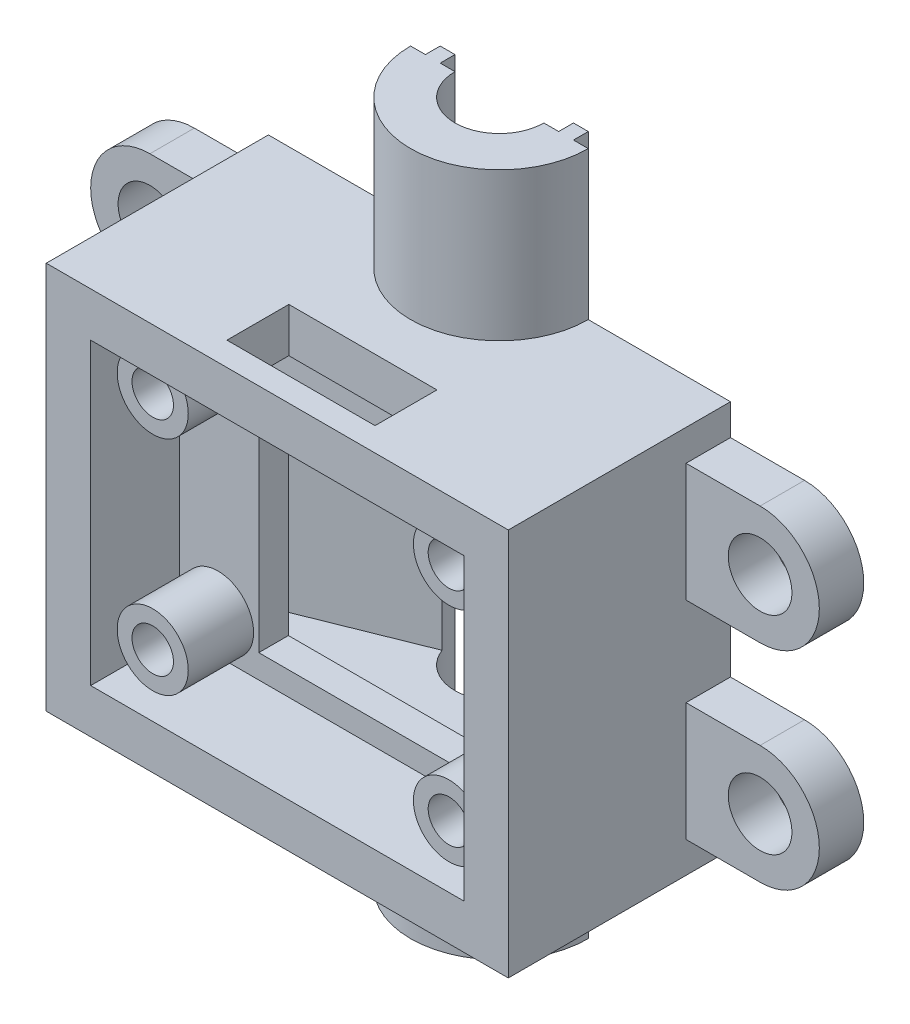
from build123d import *

# Parameters (mm, degrees)
SKETCH1_W            = 31.2
SKETCH1_H            = 26.2
BOSS_EXTRUDE1_DEPTH  = 15
SHELL2_T             = -3
BOSS_EXTRUDE2_DEPTH  = 10
CUT_EXTRUDE2_DEPTH   = 43.175822458
SKETCH8_R            = 2.15
BOSS_EXTRUDE5_DEPTH  = 3
BOSS_EXTRUDE4_DEPTH  = 1
SKETCH14_W           = 25.2
SKETCH14_H           = 20.2
CUT_EXTRUDE5_DEPTH   = 37.163102743
BOSS_EXTRUDE8_REACH  = 45.959
BOSS_EXTRUDE9_START  = -8
SKETCH15_W           = 31.2
SKETCH15_H           = 26.2
SKETCH15_W_2         = 14.5
SKETCH15_H_2         = 17
BOSS_EXTRUDE9_DEPTH  = 2
SKETCH16_R           = 2.4
SKETCH16_R_2         = 1.4
BOSS_EXTRUDE10_DEPTH = 4.41
CUT_EXTRUDE6_REACH   = 48.267
SKETCH5_W            = 10
SKETCH5_H            = 4.18


with BuildPart() as part:
    # Sketch1 → Boss-Extrude1 (new body)
    with BuildSketch(Plane.XY):
        Rectangle(SKETCH1_W, SKETCH1_H)
    extrude(amount=BOSS_EXTRUDE1_DEPTH)

    # Shell2
    shell2_openings = [part.faces().sort_by_distance(p)[0] for p in [
        (0, 0, 0),
    ]]
    offset(amount=SHELL2_T, openings=shell2_openings, kind=Kind.INTERSECTION)

    # Sketch3 → Boss-Extrude2 (add)
    with BuildSketch(Plane(origin=(0, 13.1, 0), x_dir=(1, 0, 0), z_dir=(0, 1, 0))):
        with BuildLine():
            Line((-6, 0), (-3, 0))
            ThreePointArc((-3, 0), (0, -3), (3, 0))
            Line((3, 0), (6, 0))
            ThreePointArc((6, 0), (0, -6), (-6, 0))
        make_face()
    boss_extrude2 = extrude(amount=BOSS_EXTRUDE2_DEPTH)

    # Mirror1: Boss-Extrude2 across plane
    add(boss_extrude2.mirror(Plane.ZX))

    # Sketch4 → Cut-Extrude2 (cut, through all)
    with BuildSketch(Plane(origin=(0, 13.1, 0), x_dir=(1, 0, 0), z_dir=(0, 1, 0))):
        with BuildLine():
            Line((-3, 0), (3, 0))
            ThreePointArc((3, 0), (0, -3), (-3, 0))
        make_face()
    extrude(amount=-CUT_EXTRUDE2_DEPTH, mode=Mode.SUBTRACT)

    # Sketch8 → Boss-Extrude5 (add)
    # profile 1 of 2: a face of its own
    with BuildSketch(Plane(origin=(0, 0, 0), x_dir=(-1, 0, 0), z_dir=(0, 0, -1))):
        with BuildLine():
            Line((-15.6, 3), (-15.6, 11))
            Line((-15.6, 11), (-20.6, 11))
            ThreePointArc((-20.6, 11), (-24.6, 7), (-20.6, 3))
            Line((-20.6, 3), (-15.6, 3))
        make_face()
        with Locations((-20.6, 7)):
            Circle(SKETCH8_R, mode=Mode.SUBTRACT)
    # profile 2 of 2: a face of its own
    with BuildSketch(Plane(origin=(0, 0, 0), x_dir=(-1, 0, 0), z_dir=(0, 0, -1))):
        with BuildLine():
            Line((-15.6, -11), (-15.6, -3))
            Line((-15.6, -3), (-20.6, -3))
            ThreePointArc((-20.6, -3), (-24.6, -7), (-20.6, -11))
            Line((-20.6, -11), (-15.6, -11))
        make_face()
        with Locations((-20.6, -7)):
            Circle(SKETCH8_R, mode=Mode.SUBTRACT)
    boss_extrude5 = extrude(amount=-BOSS_EXTRUDE5_DEPTH)

    # Mirror3: Boss-Extrude5 across plane
    add(boss_extrude5.mirror(Plane(origin=(0, 0, 0), x_dir=(0, 0, 1), z_dir=(1, 0, 0))))

    # Sketch7 → Boss-Extrude4 (add)
    with BuildSketch(Plane(origin=(0, 0, 0), x_dir=(-1, 0, 0), z_dir=(0, 0, -1))):
        Polygon((-4, -23.1), (-4, -11.1), (-13.6, -11.1), (-13.6, 11.1), (-4, 11.1), (-4, 23.1), (-5, 23.1), (-5, 12.1), (-14.6, 12.1), (-14.6, -12.1), (-5, -12.1), (-5, -23.1), align=None)
    boss_extrude4 = extrude(amount=BOSS_EXTRUDE4_DEPTH)

    # Mirror2: Boss-Extrude4 across plane
    add(boss_extrude4.mirror(Plane(origin=(0, 0, 0), x_dir=(0, 0, 1), z_dir=(1, 0, 0))))

    # Sketch14 → Cut-Extrude5 (cut, through all)
    with BuildSketch(Plane(origin=(0, 0, 12), x_dir=(-1, 0, 0), z_dir=(0, 0, -1))):
        Rectangle(SKETCH14_W, SKETCH14_H)
    extrude(amount=-CUT_EXTRUDE5_DEPTH, mode=Mode.SUBTRACT)

    # Sketch11 → Boss-Extrude8 (add, up to next)
    with BuildSketch(Plane(origin=(0, -10.1, 0), x_dir=(1, 0, 0), z_dir=(0, 1, 0)), mode=Mode.PRIVATE) as boss_extrude8_sk1:
        with BuildLine():
            Line((3, 0), (12.6, 0))
            Line((12.6, 0), (12.6, -5.002969955))
            Line((12.6, -5.002969955), (2.801311304, -1.073617705))
            ThreePointArc((2.801311304, -1.073617705), (2.949909652, -0.545924027), (3, 0))
        make_face()
    boss_extrude8_tool1 = extrude(boss_extrude8_sk1.sketch, amount=BOSS_EXTRUDE8_REACH, mode=Mode.PRIVATE) - part.part
    # Sketch11 → Boss-Extrude8 (add, up to next)
    with BuildSketch(Plane(origin=(0, -10.1, 0), x_dir=(1, 0, 0), z_dir=(0, 1, 0)), mode=Mode.PRIVATE) as boss_extrude8_sk2:
        with BuildLine():
            Line((-12.6, -5.002969955), (-2.801311304, -1.073617705))
            ThreePointArc((-2.801311304, -1.073617705), (-2.949909652, -0.545924027), (-3, 0))
            Line((-3, 0), (-12.6, 0))
            Line((-12.6, 0), (-12.6, -5.002969955))
        make_face()
    boss_extrude8_tool2 = extrude(boss_extrude8_sk2.sketch, amount=BOSS_EXTRUDE8_REACH, mode=Mode.PRIVATE) - part.part
    add(boss_extrude8_tool1.solids().sort_by_distance((8.785084, -10.1, 1.737296))[0])
    add(boss_extrude8_tool2.solids().sort_by_distance((-8.785084, -10.1, 1.737296))[0])

    # Sketch15 → Boss-Extrude9 (add)
    with BuildSketch(Plane.XY.offset(15).offset(BOSS_EXTRUDE9_START)):
        Rectangle(SKETCH15_W, SKETCH15_H)
        Rectangle(SKETCH15_W_2, SKETCH15_H_2, mode=Mode.SUBTRACT)
    extrude(amount=BOSS_EXTRUDE9_DEPTH)

    # Sketch16 → Boss-Extrude10 (add)
    # profile 1 of 4: a face of its own
    with BuildSketch(Plane.XY.offset(9)):
        with Locations((-10, 7.5)):
            Circle(SKETCH16_R)
        with Locations((-10, 7.5)):
            Circle(SKETCH16_R_2, mode=Mode.SUBTRACT)
    # profile 2 of 4: a face of its own
    with BuildSketch(Plane.XY.offset(9)):
        with Locations((10, 7.5)):
            Circle(SKETCH16_R)
        with Locations((10, 7.5)):
            Circle(SKETCH16_R_2, mode=Mode.SUBTRACT)
    # profile 3 of 4: a face of its own
    with BuildSketch(Plane.XY.offset(9)):
        with Locations((-10, -7.5)):
            Circle(SKETCH16_R)
        with Locations((-10, -7.5)):
            Circle(SKETCH16_R_2, mode=Mode.SUBTRACT)
    # profile 4 of 4: a face of its own
    with BuildSketch(Plane.XY.offset(9)):
        with Locations((10, -7.5)):
            Circle(SKETCH16_R)
        with Locations((10, -7.5)):
            Circle(SKETCH16_R_2, mode=Mode.SUBTRACT)
    extrude(amount=BOSS_EXTRUDE10_DEPTH)

    # Sketch5 → Cut-Extrude6 (cut, up to next)
    with BuildSketch(Plane(origin=(0, 13.1, 0), x_dir=(1, 0, 0), z_dir=(0, 1, 0)), mode=Mode.PRIVATE) as cut_extrude6_sk1:
        with Locations((0, -11.31)):
            Rectangle(SKETCH5_W, SKETCH5_H)
    cut_extrude6_tool1 = extrude(cut_extrude6_sk1.sketch, amount=-CUT_EXTRUDE6_REACH, mode=Mode.PRIVATE) & part.part
    add(cut_extrude6_tool1.solids().sort_by_distance((0, 13.1, 11.31))[0], mode=Mode.SUBTRACT)


solid = part.part
